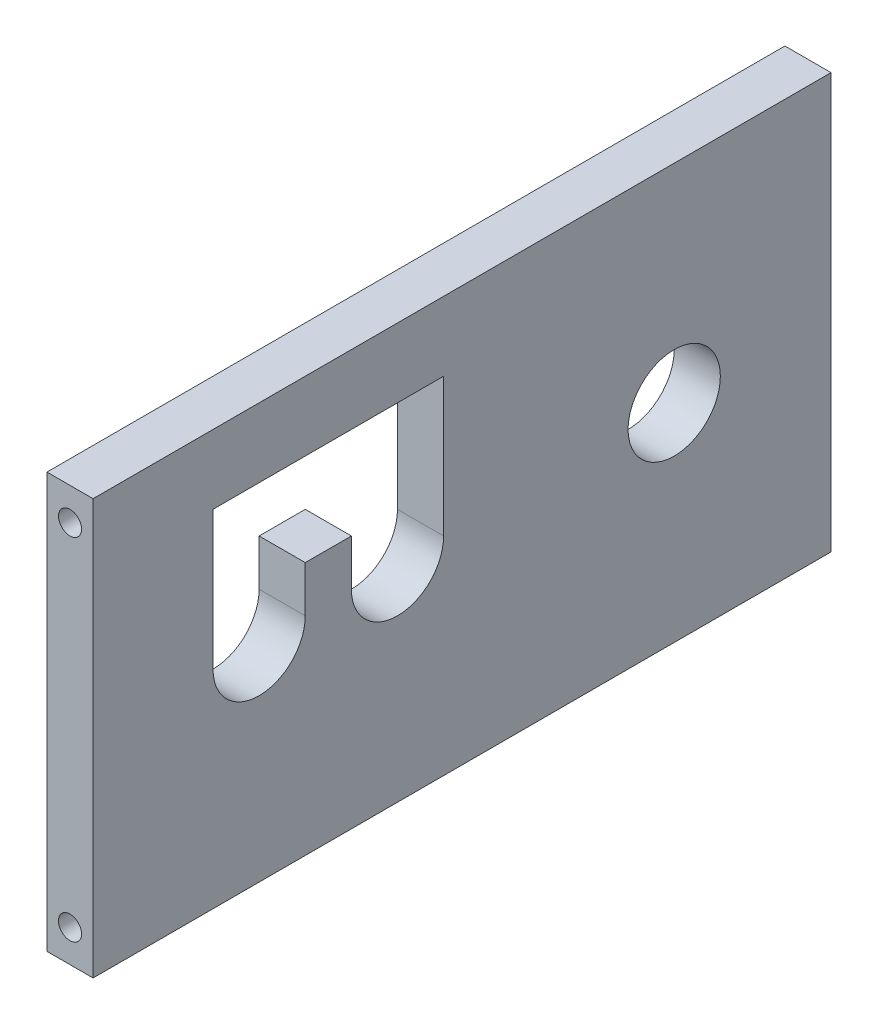
from build123d import *

# Parameters (mm, degrees)
SKETCH_2_W                  = 80
SKETCH_2_H                  = 45
EXTRUDE_2_DEPTH             = 5
HOLE_WIZARD_M3_1_AT_2_COUNT = 2
HOLE_WIZARD_M3_1_AT_2_PITCH = 38
SKETCH_5_R                  = 5
CUT_EXTRUDE_1_DEPTH         = 10
CUT_EXTRUDE_2_DEPTH         = 10


with BuildPart() as part:
    # 草图2 → 凸台-拉伸2 (new body)
    with BuildSketch(Plane(origin=(0, 0, 0), x_dir=(0, 0, -1), z_dir=(1, 0, 0))):
        Rectangle(SKETCH_2_W, SKETCH_2_H)
    extrude(amount=-EXTRUDE_2_DEPTH)

    # 草图12 → M3 螺纹孔1 (revolve, cut)
    with BuildSketch(Plane(origin=(-2.5, 19, 40), x_dir=(0, -1, 0), z_dir=(1, 0, 0))):
        Polygon((0, 0), (0, 8.251075774), (1.25, 7.5), (1.25, 0), align=None)
    hole_wizard_m3_1 = revolve(axis=Axis((-2.5, 19, 46.35), (0, 0, -1)), mode=Mode.SUBTRACT)

    # M3 螺纹孔1 at 2: M3 螺纹孔1 ×2
    with Locations(*[(0, -i * HOLE_WIZARD_M3_1_AT_2_PITCH, 0) for i in range(1, HOLE_WIZARD_M3_1_AT_2_COUNT)]):
        add(hole_wizard_m3_1, mode=Mode.SUBTRACT)

    # 镜向1: M3 螺纹孔1 across plane
    add(hole_wizard_m3_1.mirror(Plane.XY), mode=Mode.SUBTRACT)

    # 镜向1 copy 1 sketch → 镜向1 copy 1 (revolve, cut)
    with BuildSketch(Plane(origin=(-2.5, -19, -40), x_dir=(0, -1, 0), z_dir=(1, 0, 0))):
        Polygon((0, 0), (0, -8.251075774), (1.25, -7.5), (1.25, 0), align=None)
    revolve(axis=Axis((-2.5, -19, -46.35), (0, 0, -1)), mode=Mode.SUBTRACT)

    # 草图5 → 切除-拉伸1 (cut)
    with BuildSketch(Plane(origin=(0, 0, 0), x_dir=(0, 0, -1), z_dir=(1, 0, 0))):
        with Locations((-7, 0)):
            Circle(SKETCH_5_R)
        with Locations((23, 0)):
            Circle(SKETCH_5_R)
        with Locations((-22, 0)):
            Circle(SKETCH_5_R)
    extrude(amount=-CUT_EXTRUDE_1_DEPTH, mode=Mode.SUBTRACT)

    # 草图13 → 切除-拉伸2 (cut)
    with BuildSketch(Plane(origin=(0, 0, 0), x_dir=(0, 0, -1), z_dir=(1, 0, 0))):
        Polygon((-27, 0), (-27, 15), (-13.340798137, 15), (-4.226787528, 15), (-2, 15), (-2, 0), (-12, 0), (-12, 5), (-17, 5), (-17, 0), align=None)
    extrude(amount=-CUT_EXTRUDE_2_DEPTH, mode=Mode.SUBTRACT)


solid = part.part
